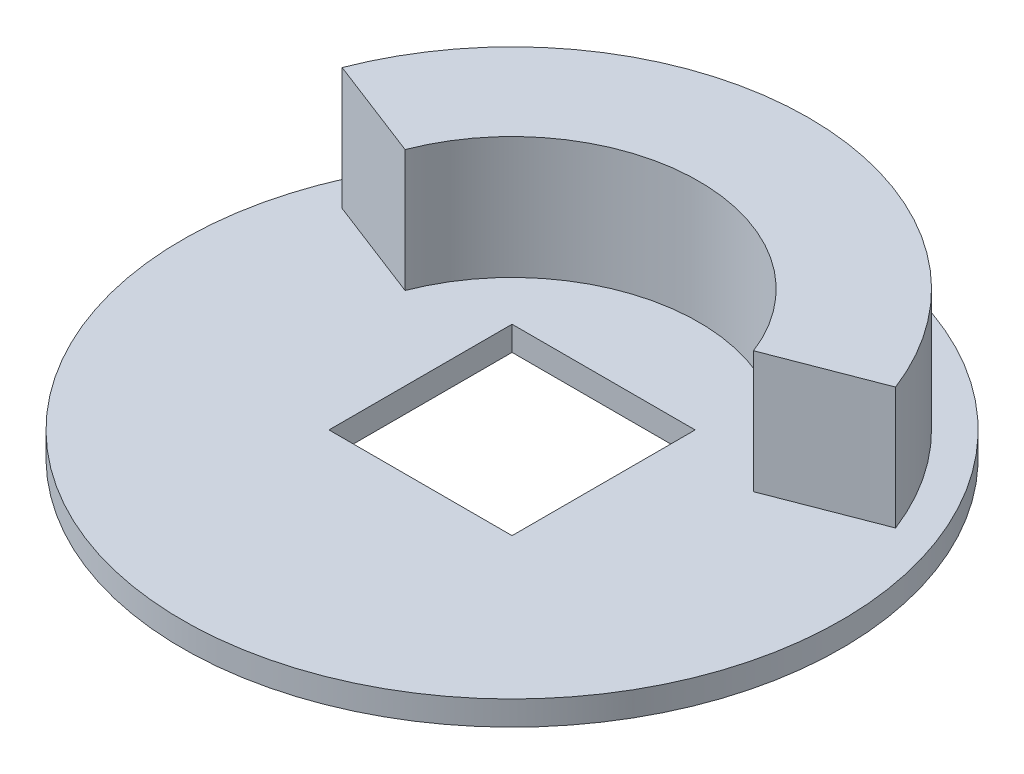
from build123d import *

# Parameters (mm, degrees)
BOSS_EXTRUDE1_DEPTH = 10
SKETCH2_R           = 27
SKETCH2_W           = 15
SKETCH2_H           = 15
BOSS_EXTRUDE2_DEPTH = 2


with BuildPart() as part:
    # Sketch1 → Boss-Extrude1 (new body)
    with BuildSketch(Plane(origin=(0, 0, 0), x_dir=(1, 0, 0), z_dir=(0, 1, 0))):
        with BuildLine():
            Line((-22.669793675, 8.750454545), (-14.273573795, 5.509545455))
            ThreePointArc((-14.273573795, 5.509545455), (0, 15.3), (14.273573795, 5.509545455))
            Line((14.273573795, 5.509545455), (22.669793675, 8.750454545))
            ThreePointArc((22.669793675, 8.750454545), (0, 24.3), (-22.669793675, 8.750454545))
        make_face()
    extrude(amount=BOSS_EXTRUDE1_DEPTH)

    # Sketch2 → Boss-Extrude2 (add)
    with BuildSketch(Plane.XZ):
        with Locations(Location((0, 0, 0), (0, 0, 270))):
            Circle(SKETCH2_R)
        Rectangle(SKETCH2_W, SKETCH2_H, mode=Mode.SUBTRACT)
    extrude(amount=BOSS_EXTRUDE2_DEPTH)


solid = part.part
